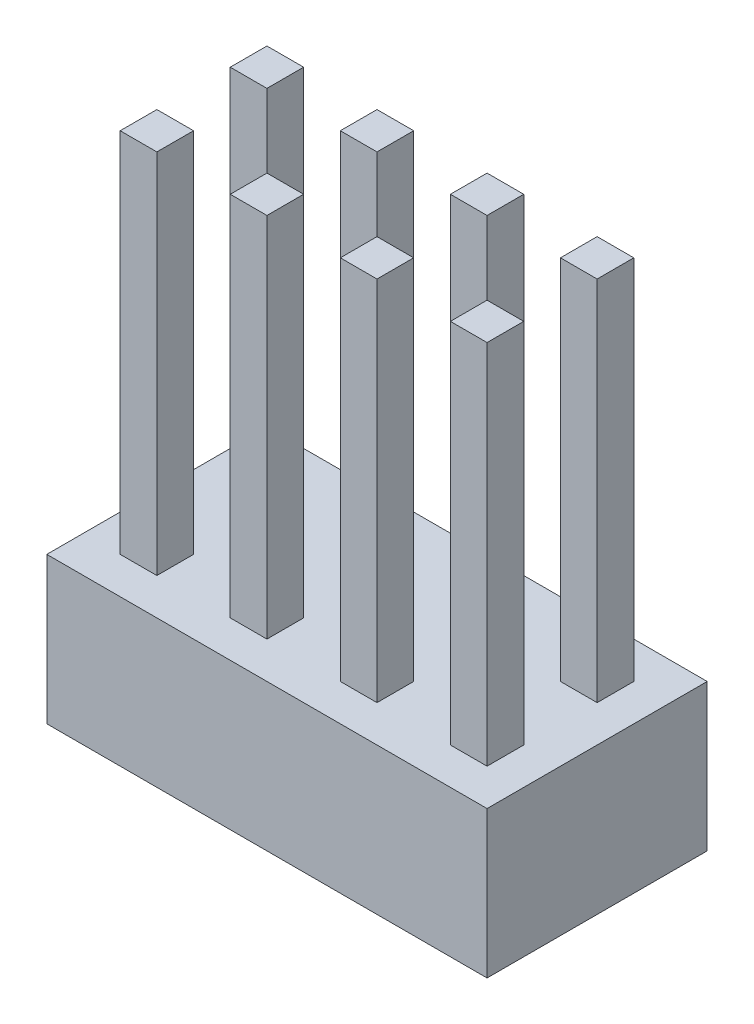
from build123d import *

# Parameters (mm, degrees)
SKETCH1_W      = 9.144
SKETCH1_H      = 4.572
EXTRUDE1_DEPTH = 3.048
SKETCH2_W      = 0.762
SKETCH2_H      = 0.762
EXTRUDE2_DEPTH = 7.62


with BuildPart() as part:
    # Sketch1 → Extrude1 (new body)
    with BuildSketch(Plane(origin=(0, 0, 0), x_dir=(1, 0, 0), z_dir=(0, 1, 0))):
        with Locations((4.572, 2.286)):
            Rectangle(SKETCH1_W, SKETCH1_H)
    extrude(amount=EXTRUDE1_DEPTH)

    # Sketch2 → Extrude2 (add)
    with BuildSketch(Plane(origin=(0, 3.048, 0), x_dir=(1, 0, 0), z_dir=(0, 1, 0))):
        with Locations((3.429, 3.429)):
            Rectangle(SKETCH2_W, SKETCH2_H)
        with Locations((1.143, 3.429)):
            Rectangle(SKETCH2_W, SKETCH2_H)
        with Locations((5.715, 3.429)):
            Rectangle(SKETCH2_W, SKETCH2_H)
        with Locations((8.001, 3.429)):
            Rectangle(SKETCH2_W, SKETCH2_H)
        with Locations((1.143, 1.143)):
            Rectangle(SKETCH2_W, SKETCH2_H)
        with Locations((3.429, 1.143)):
            Rectangle(SKETCH2_W, SKETCH2_H)
        with Locations((5.715, 1.143)):
            Rectangle(SKETCH2_W, SKETCH2_H)
        with Locations((8.001, 1.143)):
            Rectangle(SKETCH2_W, SKETCH2_H)
    extrude(amount=EXTRUDE2_DEPTH)


solid = part.part
